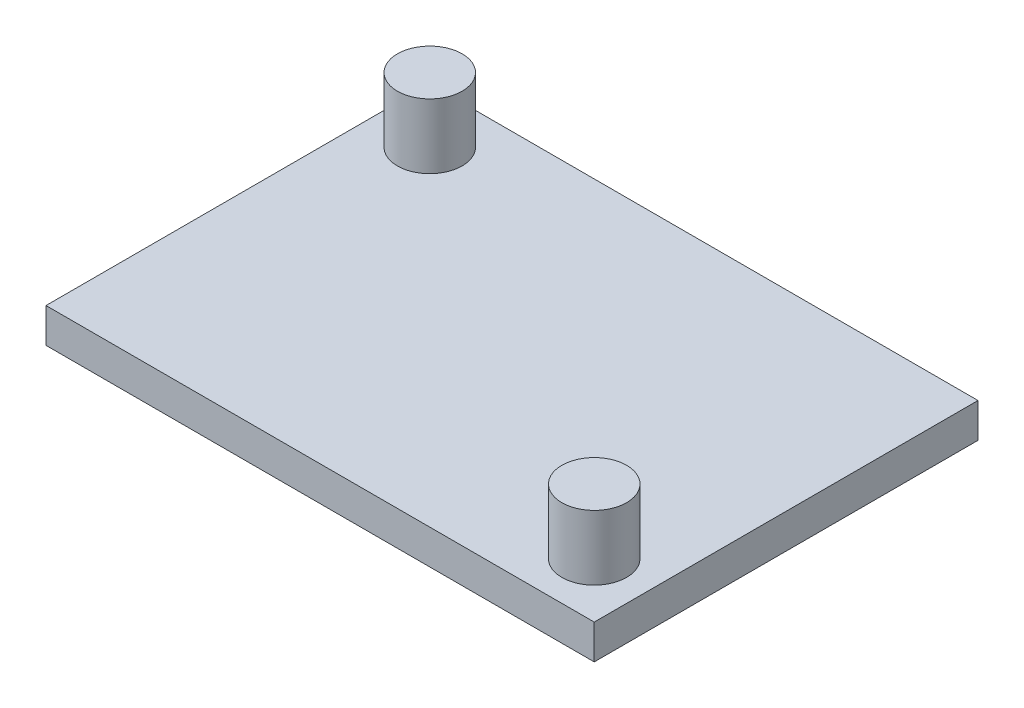
from build123d import *

# Parameters (mm, degrees)
P01_STANDOFF_START      = 3
SK_P01_STANDOFF_R       = 1.5
P01_STANDOFF_DEPTH      = 3
P02_STANDOFF_START      = 3
SK_P02_STANDOFF_R       = 1.5
P02_STANDOFF_DEPTH      = 3
P03_VL53L4CDBOARD_START = 1.4
SK_P03_VL53L4CDBOARD_W  = 25.4
SK_P03_VL53L4CDBOARD_H  = 17.78
P03_VL53L4CDBOARD_DEPTH = 1.6
SK_P04_TOFSENSOR_W      = 5
SK_P04_TOFSENSOR_H      = 3
P04_TOFSENSOR_DEPTH     = 1.4


with BuildPart() as part:
    # SK_P01_Standoff → P01_Standoff (new body)
    with BuildSketch(Plane(origin=(0, 0, 0), x_dir=(1, 0, 0), z_dir=(0, 1, 0)).offset(P01_STANDOFF_START)):
        with Locations(Location((-10.16, 6.35, 0), (0, 0, 270))):
            Circle(SK_P01_STANDOFF_R)
    extrude(amount=P01_STANDOFF_DEPTH)



with BuildPart() as body_2:
    # SK_P02_Standoff → P02_Standoff (new body)
    with BuildSketch(Plane(origin=(0, 0, 0), x_dir=(1, 0, 0), z_dir=(0, 1, 0)).offset(P02_STANDOFF_START)):
        with Locations(Location((10.16, -6.35, 0), (0, 0, 270))):
            Circle(SK_P02_STANDOFF_R)
    extrude(amount=P02_STANDOFF_DEPTH)


with BuildPart() as part_1:
    add(part.part)

    add(body_2.part)  # P03_VL53L4CDboard merges body 2
    # SK_P03_VL53L4CDboard → P03_VL53L4CDboard (add)
    with BuildSketch(Plane(origin=(0, 0, 0), x_dir=(1, 0, 0), z_dir=(0, 1, 0)).offset(P03_VL53L4CDBOARD_START)):
        Rectangle(SK_P03_VL53L4CDBOARD_W, SK_P03_VL53L4CDBOARD_H)
    extrude(amount=P03_VL53L4CDBOARD_DEPTH)

    # SK_P04_ToFsensor → P04_ToFsensor (add)
    with BuildSketch(Plane(origin=(0, 0, 0), x_dir=(1, 0, 0), z_dir=(0, 1, 0))):
        Rectangle(SK_P04_TOFSENSOR_W, SK_P04_TOFSENSOR_H)
    extrude(amount=P04_TOFSENSOR_DEPTH)


solid = part_1.part
